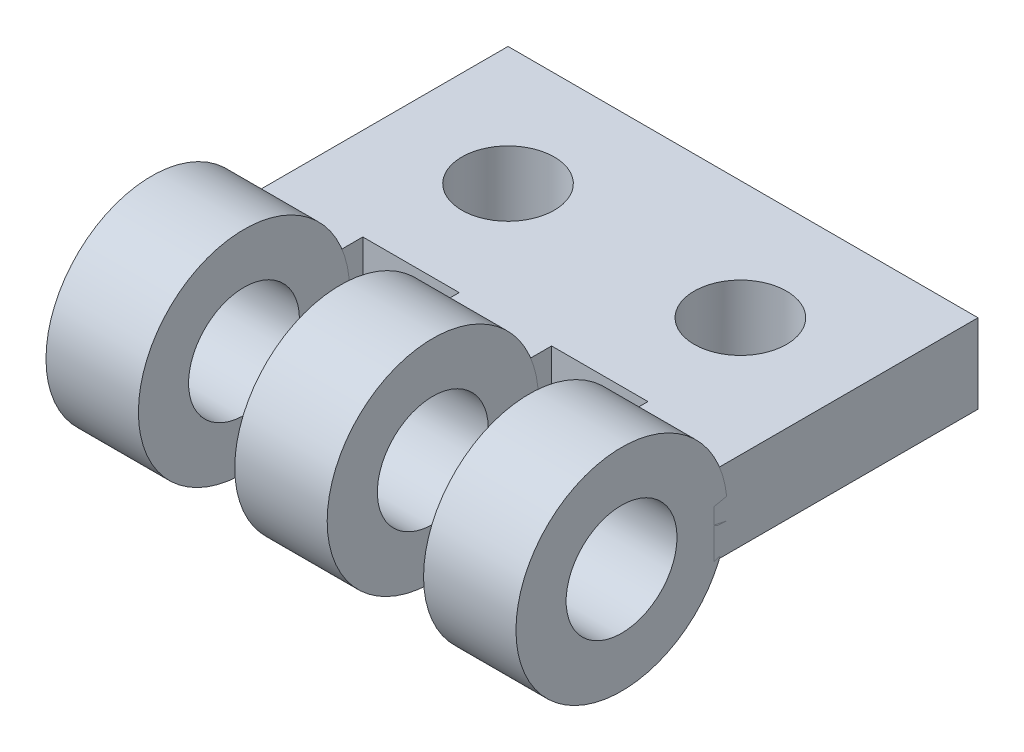
from build123d import *

# Parameters (mm, degrees)
CROQUIS1_R              = 4
CROQUIS1_R_2            = 2.1
SALIENTE_EXTRUIR1_DEPTH = 3.5
MATRIZL3_COUNT          = 3
MATRIZL3_PITCH          = 7.15
CROQUIS4_W              = 17.8
CROQUIS4_H              = 3
SALIENTE_EXTRUIR2_DEPTH = 10
CROQUIS5_R              = 1.75
CORTAR_EXTRUIR1_DEPTH   = 21.420333004
CROQUIS7_W              = 9.009755456
CROQUIS7_H              = 10.218848088
CORTAR_EXTRUIR2_DEPTH   = 3.65
CROQUIS8_W              = 8.948348818
CROQUIS8_H              = 10.48285432
CORTAR_EXTRUIR3_DEPTH   = 3.65


with BuildPart() as part:
    # Croquis1 → Saliente-Extruir1 (new body)
    with BuildSketch(Plane(origin=(0, 0, 0), x_dir=(0, -1, 0), z_dir=(1, 0, 0))):
        with Locations(Location((0, 0, 0), (0, 0, 90))):
            Circle(CROQUIS1_R)
        with Locations(Location((0, 0, 0), (0, 0, 90))):
            Circle(CROQUIS1_R_2, mode=Mode.SUBTRACT)
    extrude(amount=SALIENTE_EXTRUIR1_DEPTH)


with BuildPart() as matrizl3_1:
    # MatrizL3: pattern copy
    add(part.part.moved(Location(Vector(-1, 0, 0) * (1 * MATRIZL3_PITCH))))


with BuildPart() as matrizl3_2:
    # MatrizL3: pattern copy
    add(part.part.moved(Location(Vector(-1, 0, 0) * (2 * MATRIZL3_PITCH))))


with BuildPart() as body_4:
    # Croquis4 → Saliente-Extruir2 (new body)
    with BuildSketch(Plane.XY.offset(-3.5)):
        with Locations((-5.4, 0)):
            Rectangle(CROQUIS4_W, CROQUIS4_H)
    extrude(amount=-SALIENTE_EXTRUIR2_DEPTH)

    # Croquis5 → Cortar-Extruir1 (cut, through all)
    with BuildSketch(Plane(origin=(0, 1.5, 0), x_dir=(1, 0, 0), z_dir=(0, 1, 0))):
        with Locations(Location((-1, 9, 0), (0, 0, 270))):
            Circle(CROQUIS5_R)
        with Locations(Location((-9.8, 9, 0), (0, 0, 90))):
            Circle(CROQUIS5_R)
    extrude(amount=-CORTAR_EXTRUIR1_DEPTH, mode=Mode.SUBTRACT)

    # Croquis7 → Cortar-Extruir2 (cut)
    with BuildSketch(Plane.ZY):
        with Locations((0.004877728, 0)):
            Rectangle(CROQUIS7_W, CROQUIS7_H)
    extrude(amount=CORTAR_EXTRUIR2_DEPTH, mode=Mode.SUBTRACT)

    # Croquis8 → Cortar-Extruir3 (cut)
    with BuildSketch(Plane.ZY.offset(7.15)):
        with Locations((-0.025825591, 0)):
            Rectangle(CROQUIS8_W, CROQUIS8_H)
    extrude(amount=CORTAR_EXTRUIR3_DEPTH, mode=Mode.SUBTRACT)


solid = Compound([part.part, matrizl3_1.part, matrizl3_2.part, body_4.part])
